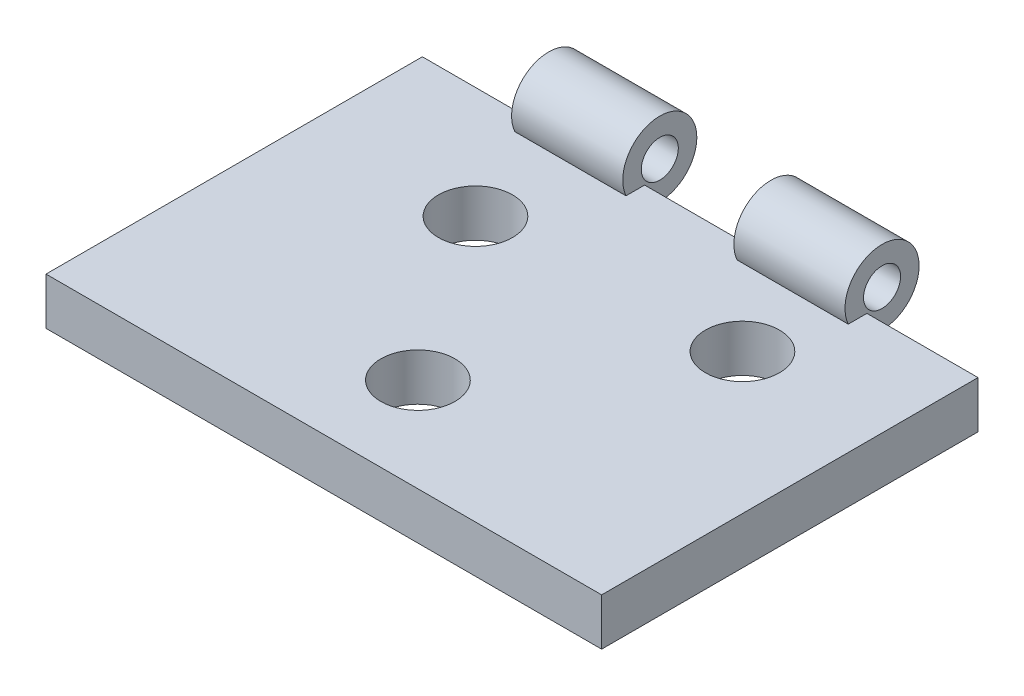
from build123d import *

# Parameters (mm, degrees)
SKETCH1_W           = 75
SKETCH1_H           = 50.8
SKETCH1_R           = 5
BOSS_EXTRUDE1_DEPTH = 6.35
BOSS_EXTRUDE2_START = -15
SKETCH2_R           = 5
BOSS_EXTRUDE2_DEPTH = 15
LPATTERN1_COUNT     = 2
LPATTERN1_PITCH     = 30
SKETCH2_4_R         = 2.5
CUT_EXTRUDE2_DEPTH  = 83.80956065


with BuildPart() as part:
    # Sketch1 → Boss-Extrude1 (new body)
    with BuildSketch(Plane(origin=(0, 0, 0), x_dir=(1, 0, 0), z_dir=(0, 1, 0))):
        Rectangle(SKETCH1_W, SKETCH1_H)
        with Locations((0, -12.7)):
            Circle(SKETCH1_R, mode=Mode.SUBTRACT)
        with Locations((-15.279173033, 10.349093201)):
            Circle(SKETCH1_R, mode=Mode.SUBTRACT)
        with Locations((18.543836974, 12.56035891)):
            Circle(SKETCH1_R, mode=Mode.SUBTRACT)
    extrude(amount=BOSS_EXTRUDE1_DEPTH)

    # Sketch2 → Boss-Extrude2 (add)
    with BuildSketch(Plane.ZY.offset(37.5).offset(BOSS_EXTRUDE2_START)):
        with Locations((-27.448482339, 8.398482339)):
            Circle(SKETCH2_R)
    boss_extrude2 = extrude(amount=-BOSS_EXTRUDE2_DEPTH)

    # LPattern1: Boss-Extrude2 ×2
    with Locations(*[(i * LPATTERN1_PITCH, 0, 0) for i in range(1, LPATTERN1_COUNT)]):
        add(boss_extrude2)

    # Sketch2<4> → Cut-Extrude2 (cut, through all)
    with BuildSketch(Plane.ZY.offset(37.5)):
        with Locations((-27.448482339, 8.398482339)):
            Circle(SKETCH2_4_R)
    extrude(amount=-CUT_EXTRUDE2_DEPTH, mode=Mode.SUBTRACT)


solid = part.part
